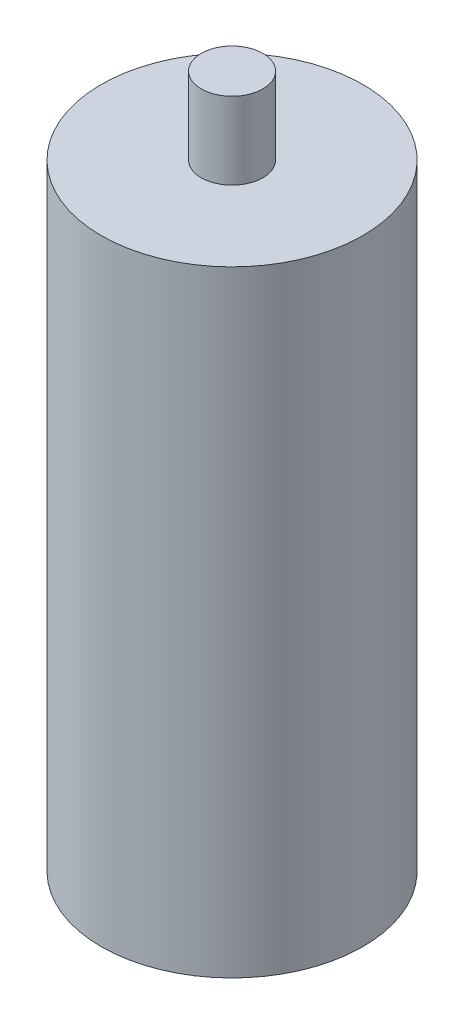
from build123d import *

# Parameters (mm, degrees)
SKETCH_1_R      = 17
EXTRUDE_1_DEPTH = 80
SKETCH_2_R      = 4
EXTRUDE_2_DEPTH = 10


with BuildPart() as part:
    # 草图1 → 凸台-拉伸1 (new body)
    with BuildSketch(Plane(origin=(0, 0, 0), x_dir=(1, 0, 0), z_dir=(0, 1, 0))):
        with Locations(Location((0, 0, 0), (0, 0, 270))):
            Circle(SKETCH_1_R)
    extrude(amount=EXTRUDE_1_DEPTH)

    # 草图2 → 凸台-拉伸2 (add)
    with BuildSketch(Plane(origin=(0, 80, 0), x_dir=(1, 0, 0), z_dir=(0, 1, 0))):
        with Locations(Location((0, 0, 0), (0, 0, 270))):
            Circle(SKETCH_2_R)
    extrude(amount=EXTRUDE_2_DEPTH)


solid = part.part
